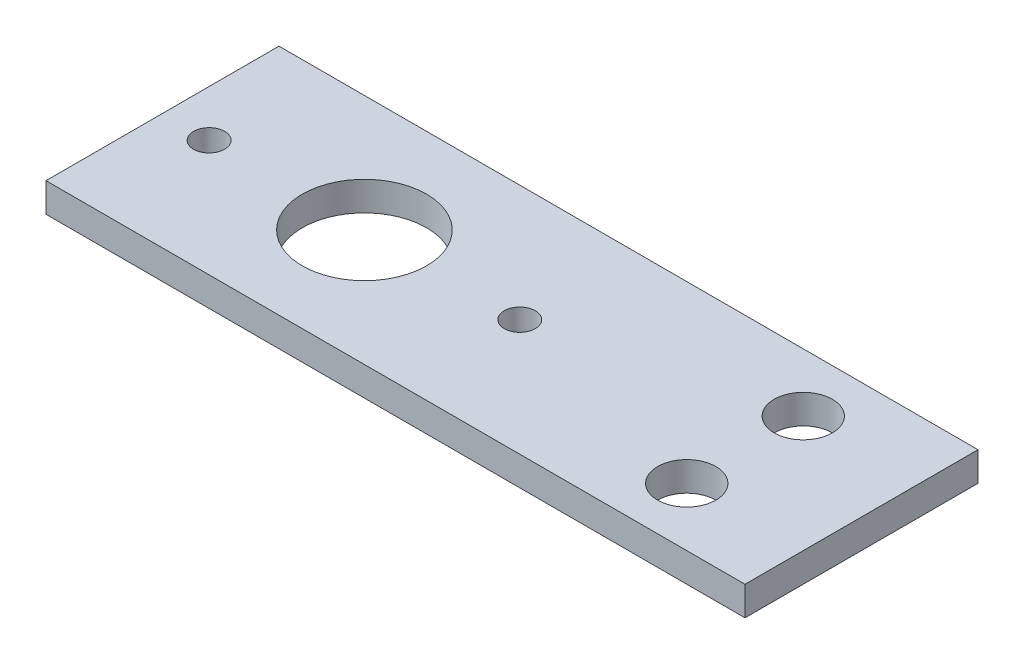
from build123d import *

# Parameters (mm, degrees)
SKETCH3_W           = 114.3
SKETCH3_H           = 38.1
SKETCH3_R           = 2.54
SKETCH3_R_2         = 10.16
SKETCH3_R_3         = 4.7625
BOSS_EXTRUDE1_DEPTH = 4.7625


with BuildPart() as part:
    # Sketch3 → Boss-Extrude1 (new body)
    with BuildSketch(Plane(origin=(0, 0, 0), x_dir=(1, 0, 0), z_dir=(0, 1, 0))):
        with Locations((-57.15, 0)):
            Rectangle(SKETCH3_W, SKETCH3_H)
        with Locations(Location((-106.68, 0, 0), (0, 0, 90))):
            Circle(SKETCH3_R, mode=Mode.SUBTRACT)
        with Locations(Location((-81.28, 0, 0), (0, 0, 90))):
            Circle(SKETCH3_R_2, mode=Mode.SUBTRACT)
        with Locations(Location((-55.88, 0, 0), (0, 0, 90))):
            Circle(SKETCH3_R, mode=Mode.SUBTRACT)
        with Locations(Location((-19.05, 9.525, 0), (0, 0, 90))):
            Circle(SKETCH3_R_3, mode=Mode.SUBTRACT)
        with Locations(Location((-19.05, -9.525, 0), (0, 0, 90))):
            Circle(SKETCH3_R_3, mode=Mode.SUBTRACT)
    extrude(amount=BOSS_EXTRUDE1_DEPTH)


solid = part.part
